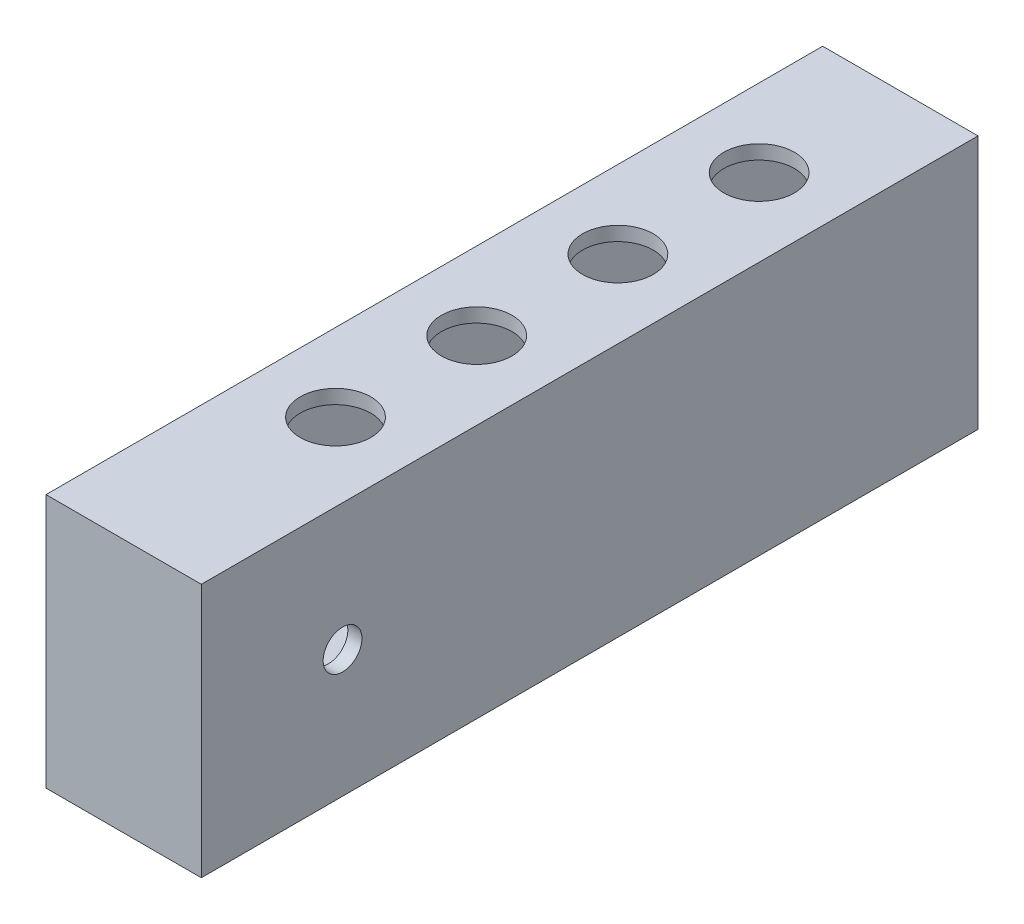
from build123d import *

# Parameters (mm, degrees)
ESBO_O1_W                = 22
ESBO_O1_H                = 36
RESSALTO_EXTRUS_O1_DEPTH = 110
CASCA1_T                 = -2
ESBO_O2_R                = 5
CORTE_EXTRUS_O1_DEPTH    = 1000
ESBO_O3_R                = 2.75
CORTE_EXTRUS_O2_DEPTH    = 29


with BuildPart() as part:
    # Esboço1 → Ressalto-extrusão1 (new body)
    with BuildSketch(Plane.XY):
        with Locations((0, 18)):
            Rectangle(ESBO_O1_W, ESBO_O1_H)
    extrude(amount=RESSALTO_EXTRUS_O1_DEPTH)

    # Casca1
    casca1_openings = [part.faces().sort_by_distance(p)[0] for p in [
        (0, 18, 0),
    ]]
    offset(amount=CASCA1_T, openings=casca1_openings, kind=Kind.INTERSECTION)

    # Esboço2 → Corte-extrusão1 (cut)
    with BuildSketch(Plane(origin=(0, 0, 0), x_dir=(-1, 0, 0), z_dir=(0, -1, 0))):
        with Locations(Location((0, -20, 0), (0, 0, 90))):
            Circle(ESBO_O2_R)
        with Locations(Location((0, -40, 0), (0, 0, 90))):
            Circle(ESBO_O2_R)
        with Locations(Location((0, -60, 0), (0, 0, 90))):
            Circle(ESBO_O2_R)
        with Locations(Location((0, -80, 0), (0, 0, 90))):
            Circle(ESBO_O2_R)
    extrude(amount=-CORTE_EXTRUS_O1_DEPTH, mode=Mode.SUBTRACT)

    # Esboço3 → Corte-extrusão2 (cut)
    with BuildSketch(Plane(origin=(11, 0, 0), x_dir=(0, 0, -1), z_dir=(1, 0, 0))):
        with Locations(Location((-90, 18, 0), (0, 0, 90))):
            Circle(ESBO_O3_R)
    extrude(amount=-CORTE_EXTRUS_O2_DEPTH, mode=Mode.SUBTRACT)


solid = part.part
